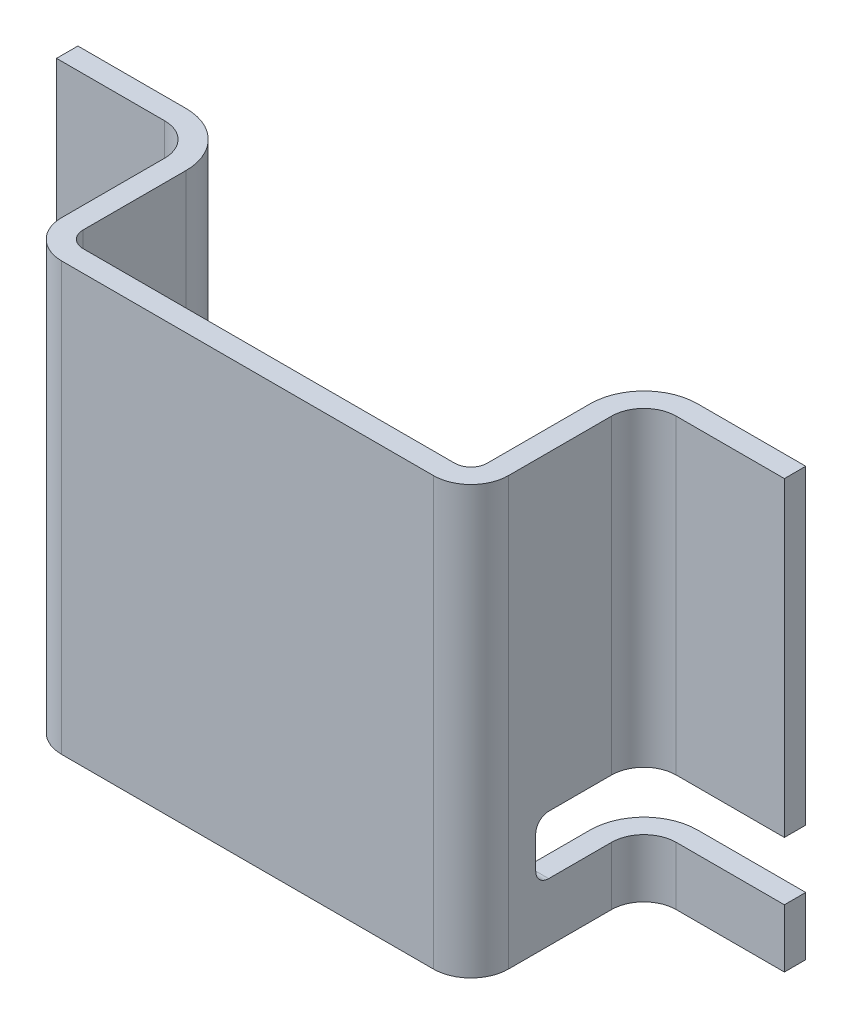
from build123d import *

# Parameters (mm, degrees)
EXTRUDE_1_DEPTH          = 3.3
CUT_EXTRUDE_1_DEPTH      = 8.174566189
CUT_EXTRUDE_1_DEPTH_BACK = 8.174566189


with BuildPart() as part:
    # Эскиз1 → Бобышка-Вытянуть1 (new, symmetric)
    with BuildSketch(Plane(origin=(0, 0, 0), x_dir=(1, 0, 0), z_dir=(0, 1, 0))):
        with BuildLine():
            Line((-5.62, 0), (-3.95, 0))
            ThreePointArc((-3.95, 0), (-3.363101372, -0.243101372), (-3.12, -0.83))
            Line((-3.12, -0.83), (-3.12, -2.42))
            ThreePointArc((-3.12, -2.42), (-3.046776695, -2.596776695), (-2.87, -2.67))
            Line((-2.87, -2.67), (2.87, -2.67))
            ThreePointArc((2.87, -2.67), (3.046776695, -2.596776695), (3.12, -2.42))
            Line((3.12, -2.42), (3.12, -0.83))
            ThreePointArc((3.12, -0.83), (3.363101372, -0.243101372), (3.95, 0))
            Line((3.95, 0), (5.62, 0))
            Line((5.62, 0), (5.62, -0.33))
            Line((5.62, -0.33), (3.95, -0.33))
            ThreePointArc((3.95, -0.33), (3.596446609, -0.476446609), (3.45, -0.83))
            Line((3.45, -0.83), (3.45, -2.42))
            ThreePointArc((3.45, -2.42), (3.280121933, -2.830121933), (2.87, -3))
            Line((2.87, -3), (-2.87, -3))
            ThreePointArc((-2.87, -3), (-3.280121933, -2.830121933), (-3.45, -2.42))
            Line((-3.45, -2.42), (-3.45, -0.83))
            ThreePointArc((-3.45, -0.83), (-3.596446609, -0.476446609), (-3.95, -0.33))
            Line((-3.95, -0.33), (-5.62, -0.33))
            Line((-5.62, -0.33), (-5.62, 0))
        make_face()
    extrude(amount=EXTRUDE_1_DEPTH, both=True)

    # Эскиз2 → Вырез-Вытянуть1 (cut, two sides: drawn at the far end of the back side and taken through both)
    with BuildSketch(Plane(origin=(0, 0, 0), x_dir=(0, 0, -1), z_dir=(1, 0, 0)).offset(-CUT_EXTRUDE_1_DEPTH_BACK)):
        with BuildLine():
            Line((0, -1.5), (0, -2.4))
            Line((0, -2.4), (-1.8, -2.4))
            ThreePointArc((-1.8, -2.4), (-1.941421356, -2.341421356), (-2, -2.2))
            Line((-2, -2.2), (-2, -1.7))
            ThreePointArc((-2, -1.7), (-1.941421356, -1.558578644), (-1.8, -1.5))
            Line((-1.8, -1.5), (0, -1.5))
        make_face()
    extrude(amount=CUT_EXTRUDE_1_DEPTH + CUT_EXTRUDE_1_DEPTH_BACK, mode=Mode.SUBTRACT)


solid = part.part
